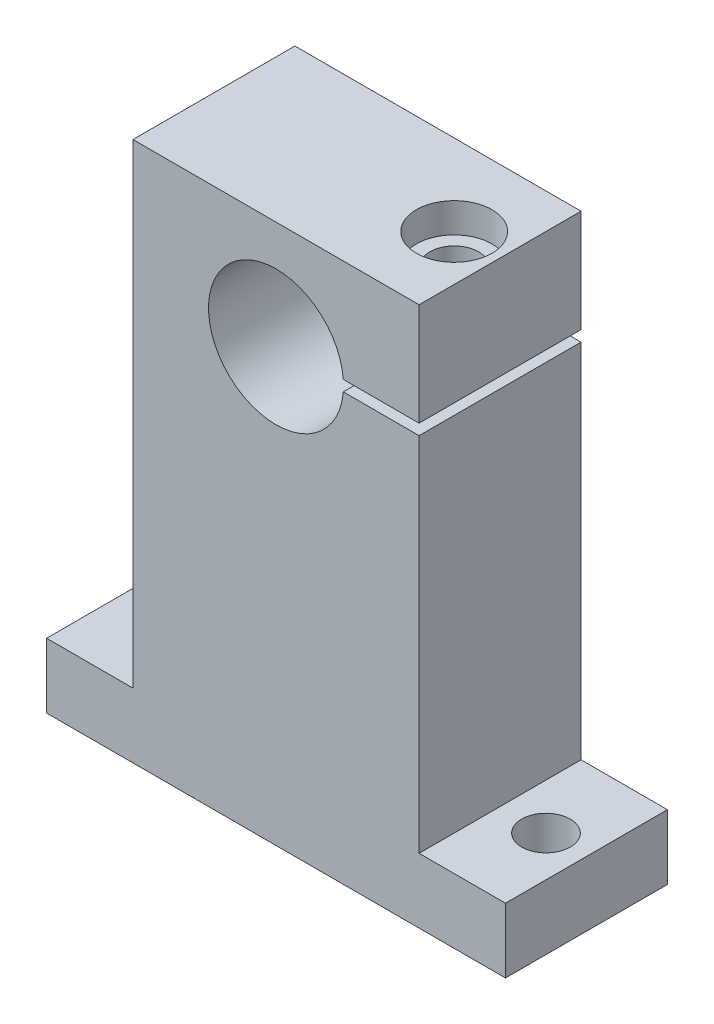
from build123d import *

# Parameters (mm, degrees)
SKETCH_1_R                   = 12.5
EXTRUDE_1_DEPTH              = 15
HOLE_WIZARD_1_D              = 9
HOLE_WIZARD_1_DEPTH          = 100
SKETCH_4_W                   = 53.346686235
SKETCH_4_H                   = 2
CUT_EXTRUDE_1_DEPTH          = 113.722003176
HOLE_WIZARD_M8_1_D           = 8.5
HOLE_WIZARD_M8_1_DEPTH       = 35
HOLE_WIZARD_M8_1_CBORE_D     = 14
HOLE_WIZARD_M8_1_CBORE_DEPTH = 5.5
HOLE_WIZARD_M8_1_TIP         = 2.553657631
CUT_EXTRUDE_2_REACH          = 106.697
SKETCH_8_R                   = 4.5


with BuildPart() as part:
    # 草图1 → 凸台-拉伸1 (new, symmetric)
    with BuildSketch(Plane.XY):
        Polygon((42.5, 0), (-42.5, 0), (-42.5, 12), (-26.5, 12), (-26.5, 100), (26.5, 100), (26.5, 12), (42.5, 12), align=None)
        with Locations((0, 80)):
            Circle(SKETCH_1_R, mode=Mode.SUBTRACT)
    extrude(amount=EXTRUDE_1_DEPTH, both=True)

    # 孔1
    with Locations(Plane.XZ):
        with Locations((-35, 0), (35, 0)):
            Hole(HOLE_WIZARD_1_D / 2, depth=HOLE_WIZARD_1_DEPTH)

    # 草图4 → 切除-拉伸1 (cut, through all)
    with BuildSketch(Plane.XY.offset(15)):
        with Locations((33.672264203, 80)):
            Rectangle(SKETCH_4_W, SKETCH_4_H)
    extrude(amount=-CUT_EXTRUDE_1_DEPTH, mode=Mode.SUBTRACT)

    # M8 六角头螺钉的柱形沉头孔1
    with Locations(Plane(origin=(-72.699544071, 100, 2.28188546), x_dir=(0, 0, -1), z_dir=(0, 1, 0))):
        with Locations((2.28188546, -90.699544071)):
            CounterBoreHole(HOLE_WIZARD_M8_1_D / 2, HOLE_WIZARD_M8_1_CBORE_D / 2, HOLE_WIZARD_M8_1_CBORE_DEPTH, depth=HOLE_WIZARD_M8_1_DEPTH)
            with Locations((0, 0, -(HOLE_WIZARD_M8_1_DEPTH + HOLE_WIZARD_M8_1_TIP / 2))):  # 118° drill point
                Cone(0, HOLE_WIZARD_M8_1_D / 2, HOLE_WIZARD_M8_1_TIP, mode=Mode.SUBTRACT)

    # 草图8 → 切除-拉伸2 (cut, up to next)
    with BuildSketch(Plane(origin=(0, 94.5, 0), x_dir=(1, 0, 0), z_dir=(0, 1, 0)), mode=Mode.PRIVATE) as cut_extrude_2_sk1:
        with Locations(Location((18, 0, 0), (0, 0, 270))):
            Circle(SKETCH_8_R)
    cut_extrude_2_tool1 = extrude(cut_extrude_2_sk1.sketch, amount=-CUT_EXTRUDE_2_REACH, mode=Mode.PRIVATE) & part.part
    add(cut_extrude_2_tool1.solids().sort_by_distance((18, 94.5, 0))[0], mode=Mode.SUBTRACT)


solid = part.part
